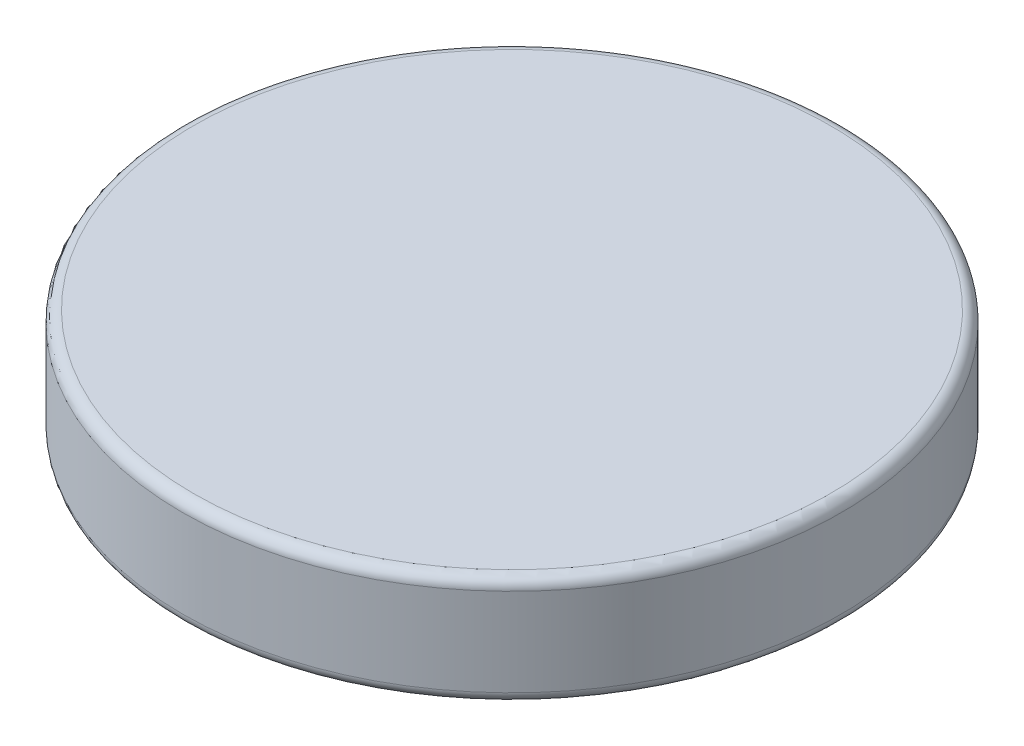
from build123d import *

# Parameters (mm, degrees)
SKETCH_1_R      = 6
EXTRUDE_1_DEPTH = 2
FILLET_1_R      = 0.2


with BuildPart() as part:
    # 草图1 → 凸台-拉伸1 (new body)
    with BuildSketch(Plane(origin=(0, 0, 0), x_dir=(1, 0, 0), z_dir=(0, 1, 0))):
        with Locations(Location((0, 0, 0), (0, 0, 270))):
            Circle(SKETCH_1_R)
    extrude(amount=EXTRUDE_1_DEPTH)

    # 圆角1
    fillet_1_edges = [part.edges().sort_by_distance(p)[0] for p in [
        (0, 0, -6),
        (0, 2, -6),
    ]]
    fillet(fillet_1_edges, radius=FILLET_1_R)


solid = part.part
